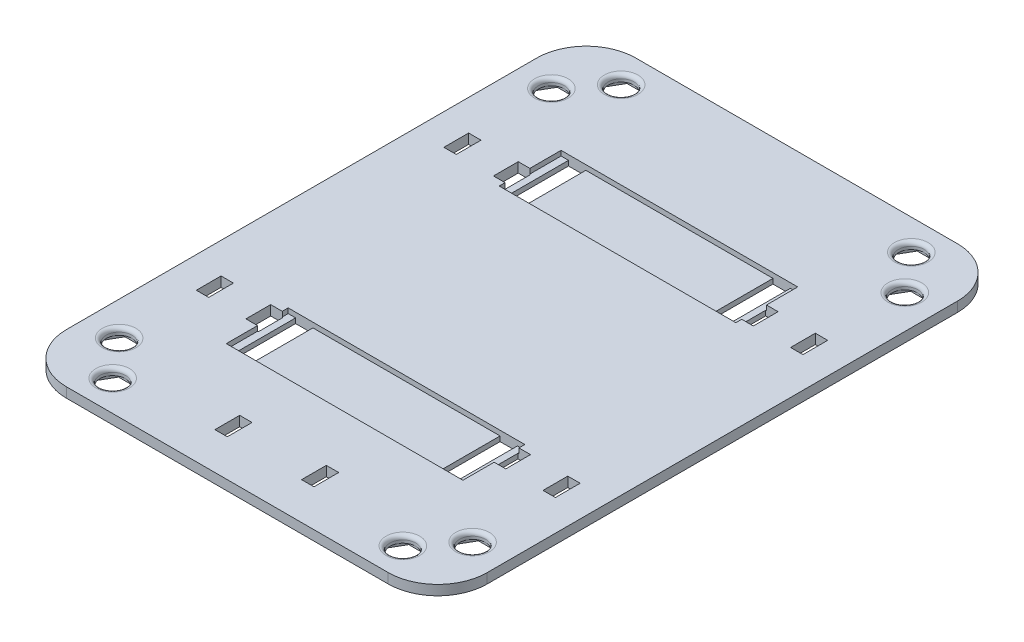
from build123d import *

# Parameters (mm, degrees)
SKETCH1_W           = 107.95
SKETCH1_H           = 146.05
BOSS_EXTRUDE1_DEPTH = 2.54
SKETCH2_R           = 3.302
CUT_EXTRUDE1_DEPTH  = 91.842736914
SKETCH3_W           = 4.445
SKETCH3_H           = 15.875
CUT_EXTRUDE2_DEPTH  = 91.842736914
FILLET1_R           = 12.7
SKETCH11_W          = 60.699904
SKETCH11_H          = 15.875
CUT_EXTRUDE9_DEPTH  = 1.27
FILLET2_R           = 1.016
SKETCH14_W          = 3.175
SKETCH14_H          = 6.35
CUT_EXTRUDE14_DEPTH = 91.842736914
CUT_EXTRUDE15_DEPTH = 0.79375


with BuildPart() as part:
    # Sketch1 → Boss-Extrude1 (new body)
    with BuildSketch(Plane(origin=(0, 0, 0), x_dir=(1, 0, 0), z_dir=(0, 1, 0))):
        Rectangle(SKETCH1_W, SKETCH1_H)
    extrude(amount=-BOSS_EXTRUDE1_DEPTH)

    # Sketch2 → Cut-Extrude1 (cut, through all)
    with BuildSketch(Plane(origin=(0, 0, 0), x_dir=(1, 0, 0), z_dir=(0, 1, 0))):
        with Locations((-37.218937681, 65.210784985)):
            Circle(SKETCH2_R)
        with Locations((45.326413441, 55.435363088)):
            Circle(SKETCH2_R)
        with Locations((37.218937681, 65.210784985)):
            Circle(SKETCH2_R)
        with Locations((-45.326413441, -55.435363088)):
            Circle(SKETCH2_R)
        with Locations((-45.326413441, 55.435363088)):
            Circle(SKETCH2_R)
        with Locations((-37.218937681, -65.210784985)):
            Circle(SKETCH2_R)
        with Locations((37.218937681, -65.210784985)):
            Circle(SKETCH2_R)
        with Locations((45.326413441, -55.435363088)):
            Circle(SKETCH2_R)
    extrude(amount=-CUT_EXTRUDE1_DEPTH, mode=Mode.SUBTRACT)

    # Sketch3 → Cut-Extrude2 (cut, through all)
    with BuildSketch(Plane(origin=(0, 0, 0), x_dir=(1, 0, 0), z_dir=(0, 1, 0))):
        with Locations((-26.222452, 34.99993)):
            Rectangle(SKETCH3_W, SKETCH3_H)
        with Locations((26.222452, 34.99993)):
            Rectangle(SKETCH3_W, SKETCH3_H)
        with Locations((26.222452, -34.99993)):
            Rectangle(SKETCH3_W, SKETCH3_H)
        with Locations((-26.222452, -34.99993)):
            Rectangle(SKETCH3_W, SKETCH3_H)
    extrude(amount=-CUT_EXTRUDE2_DEPTH, mode=Mode.SUBTRACT)

    # Fillet1
    fillet1_edges = [part.edges().sort_by_distance(p)[0] for p in [
        (53.975, -1.27, -73.025),
        (53.975, -1.27, 73.025),
        (-53.975, -1.27, 73.025),
        (-53.975, -1.27, -73.025),
    ]]
    fillet(fillet1_edges, radius=FILLET1_R)

    # Sketch11 → Cut-Extrude9 (cut, symmetric)
    with BuildSketch(Plane(origin=(0, 0, 0), x_dir=(1, 0, 0), z_dir=(0, 1, 0))):
        with Locations((0, -34.99993)):
            Rectangle(SKETCH11_W, SKETCH11_H)
        with Locations((0, 34.99993)):
            Rectangle(SKETCH11_W, SKETCH11_H)
    extrude(amount=CUT_EXTRUDE9_DEPTH, both=True, mode=Mode.SUBTRACT)

    # Fillet2
    fillet2_edges = [part.edges().sort_by_distance(p)[0] for p in [
        (-40.520937681, 0, -65.210784985),
        (33.916937681, 0, 65.210784985),
        (42.024413441, 0, 55.435363088),
        (-40.520937681, 0, 65.210784985),
        (-48.628413441, 0, 55.435363088),
        (42.024413441, 0, -55.435363088),
        (33.916937681, 0, -65.210784985),
        (-48.628413441, 0, -55.435363088),
    ]]
    fillet(fillet2_edges, radius=FILLET2_R)

    # Sketch14 → Cut-Extrude14 (cut, through all)
    with BuildSketch(Plane(origin=(0, 0, 0), x_dir=(1, 0, 0), z_dir=(0, 1, 0))):
        with Locations((31.7373, -31.75)):
            Rectangle(SKETCH14_W, SKETCH14_H)
        with Locations((-31.7373, -31.75)):
            Rectangle(SKETCH14_W, SKETCH14_H)
        with Locations((-31.7373, 31.75)):
            Rectangle(SKETCH14_W, SKETCH14_H)
        with Locations((31.7373, 31.75)):
            Rectangle(SKETCH14_W, SKETCH14_H)
        with Locations((-11.1125, -60.325)):
            Rectangle(SKETCH14_W, SKETCH14_H)
        with Locations((11.1125, -60.325)):
            Rectangle(SKETCH14_W, SKETCH14_H)
        with Locations((44.4627, 31.75)):
            Rectangle(SKETCH14_W, SKETCH14_H)
        with Locations((44.4627, -31.75)):
            Rectangle(SKETCH14_W, SKETCH14_H)
        with Locations((-44.4627, 31.75)):
            Rectangle(SKETCH14_W, SKETCH14_H)
        with Locations((-44.4627, -31.75)):
            Rectangle(SKETCH14_W, SKETCH14_H)
    extrude(amount=-CUT_EXTRUDE14_DEPTH, mode=Mode.SUBTRACT)

    # Sketch17 → Cut-Extrude15 (cut)
    with BuildSketch(Plane.XZ.offset(2.54)):
        Polygon((43.273355884, -51.879363088), (47.379470998, -51.879363088), (49.432528556, -55.435363088), (47.379470998, -58.991363088), (43.273355884, -58.991363088), (41.220298327, -55.435363088), align=None)
        Polygon((-41.220298327, -55.435363088), (-43.273355884, -51.879363088), (-47.379470998, -51.879363088), (-49.432528556, -55.435363088), (-47.379470998, -58.991363088), (-43.273355884, -58.991363088), align=None)
        Polygon((-33.112822567, -65.210784985), (-35.165880124, -61.654784985), (-39.271995239, -61.654784985), (-41.325052796, -65.210784985), (-39.271995239, -68.766784985), (-35.165880124, -68.766784985), align=None)
        Polygon((35.165880124, -61.654784985), (39.271995239, -61.654784985), (41.325052796, -65.210784985), (39.271995239, -68.766784985), (35.165880124, -68.766784985), (33.112822567, -65.210784985), align=None)
        Polygon((-41.220298327, 55.435363088), (-43.273355884, 51.879363088), (-47.379470998, 51.879363088), (-49.432528556, 55.435363088), (-47.379470998, 58.991363088), (-43.273355884, 58.991363088), align=None)
        Polygon((-33.112822567, 65.210784985), (-35.165880124, 61.654784985), (-39.271995239, 61.654784985), (-41.325052796, 65.210784985), (-39.271995239, 68.766784985), (-35.165880124, 68.766784985), align=None)
        Polygon((39.271995239, 68.766784985), (35.165880124, 68.766784985), (33.112822567, 65.210784985), (35.165880124, 61.654784985), (39.271995239, 61.654784985), (41.325052796, 65.210784985), align=None)
        Polygon((47.379470998, 58.991363088), (43.273355884, 58.991363088), (41.220298327, 55.435363088), (43.273355884, 51.879363088), (47.379470998, 51.879363088), (49.432528556, 55.435363088), align=None)
    extrude(amount=-CUT_EXTRUDE15_DEPTH, mode=Mode.SUBTRACT)


solid = part.part
